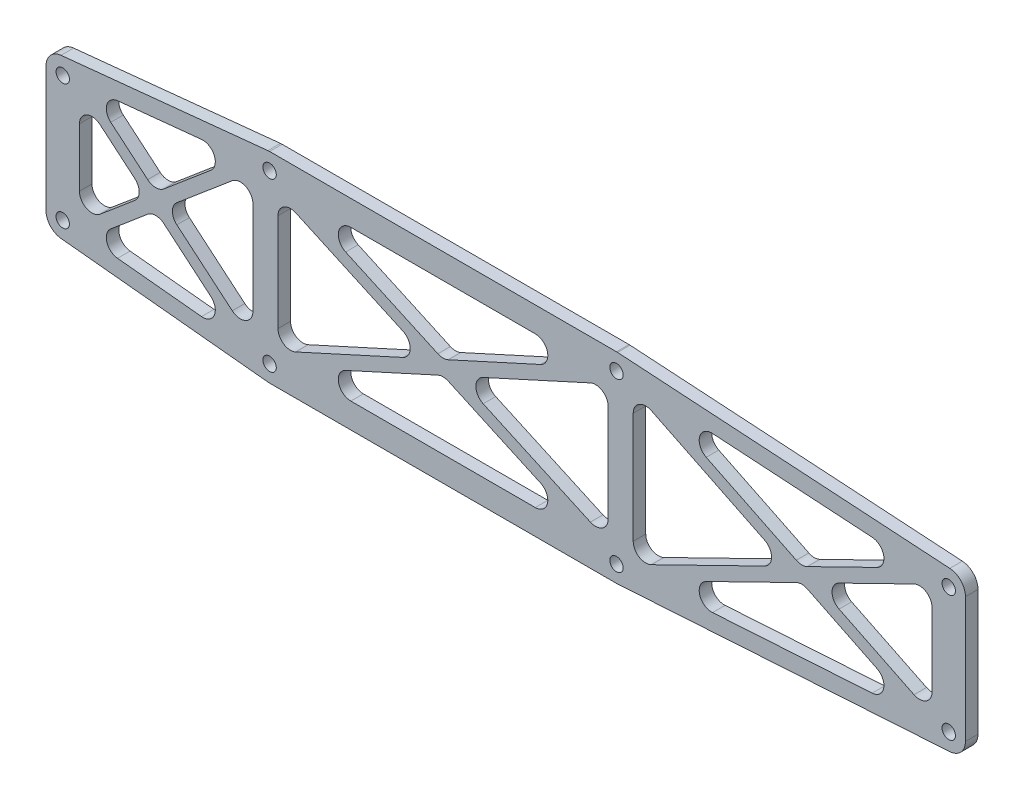
from build123d import *

# Parameters (mm, degrees)
SKETCH_1_W          = 232
SKETCH_1_H          = 56
SKETCH_1_R          = 1.6
EXTRUDE_1_DEPTH     = 3
SKETCH_2_R          = 1.6
CUT_EXTRUDE_1_DEPTH = 10
SKETCH_4_W          = 232
SKETCH_4_H          = 56
CUT_EXTRUDE_2_DEPTH = 5
CUT_EXTRUDE_3_DEPTH = 5
FILLET_1_R          = 3


with BuildPart() as part:
    # 草图1 → 凸台-拉伸1 (new body)
    with BuildSketch(Plane.XY):
        Rectangle(SKETCH_1_W, SKETCH_1_H)
        with Locations((-56.5, 20)):
            Circle(SKETCH_1_R, mode=Mode.SUBTRACT)
        with Locations((-56.5, -20)):
            Circle(SKETCH_1_R, mode=Mode.SUBTRACT)
        with Locations((26.5, -20)):
            Circle(SKETCH_1_R, mode=Mode.SUBTRACT)
        with Locations((26.5, 20)):
            Circle(SKETCH_1_R, mode=Mode.SUBTRACT)
    extrude(amount=EXTRUDE_1_DEPTH)

    # 草图2 → 切除-拉伸1 (cut)
    with BuildSketch(Plane.XY.offset(3)):
        with Locations((-106, 15)):
            Circle(SKETCH_2_R)
        with Locations((-106, -15)):
            Circle(SKETCH_2_R)
        with Locations(Location((106, -15, 0), (0, 0, 180))):
            Circle(SKETCH_2_R)
        with Locations(Location((106, 15, 0), (0, 0, 180))):
            Circle(SKETCH_2_R)
    extrude(amount=-CUT_EXTRUDE_1_DEPTH, mode=Mode.SUBTRACT)

    # 草图4 → 切除-拉伸2 (cut, symmetric)
    with BuildSketch(Plane.XY.offset(3)):
        Rectangle(SKETCH_4_W, SKETCH_4_H)
        with BuildLine():
            ThreePointArc((106.251076246, 18.992112313), (108.915845073, 17.73821977), (110, 15))
            Line((110, 15), (110, -15))
            ThreePointArc((110, -15), (108.915845073, -17.73821977), (106.251076246, -18.992112313))
            Line((106.251076246, -18.992112313), (26.751076246, -23.992112313))
            ThreePointArc((26.751076246, -23.992112313), (26.625600057, -23.998027592), (26.5, -24))
            Line((26.5, -24), (-56.5, -24))
            ThreePointArc((-56.5, -24), (-56.701252299, -23.994933981), (-56.901994824, -23.979748756))
            Line((-56.901994824, -23.979748756), (-106.401994824, -18.979748756))
            ThreePointArc((-106.401994824, -18.979748756), (-108.967151774, -17.682538043), (-110, -15))
            Line((-110, -15), (-110, 15))
            ThreePointArc((-110, 15), (-108.967151774, 17.682538043), (-106.401994824, 18.979748756))
            Line((-106.401994824, 18.979748756), (-56.901994824, 23.979748756))
            ThreePointArc((-56.901994824, 23.979748756), (-56.701252299, 23.994933981), (-56.5, 24))
            Line((-56.5, 24), (26.5, 24))
            ThreePointArc((26.5, 24), (26.625600057, 23.998027592), (26.751076246, 23.992112313))
            Line((26.751076246, 23.992112313), (106.251076246, 18.992112313))
        make_face(mode=Mode.SUBTRACT)
    extrude(amount=CUT_EXTRUDE_2_DEPTH, both=True, mode=Mode.SUBTRACT)

    # 草图6 → 切除-拉伸3 (cut, symmetric)
    with BuildSketch(Plane.XY.offset(3)):
        Polygon((-63.143230899, 19.328966576), (-99.922202515, 15.613918938), (-83.735209235, 1.962237858), align=None)
        Polygon((-60.5, 17.633721737), (-81.408555774, 0), (-60.5, -17.633721737), align=None)
        Polygon((-63.143230899, -19.328966576), (-83.735209235, -1.962237858), (-99.922202515, -15.613918938), align=None)
        Polygon((-86.061862696, 0), (-102, 13.441802546), (-102, -13.441802546), align=None)
        Polygon((-18.617329048, 0), (-54.5, 16.351596889), (-54.5, -16.351596889), align=None)
        Polygon((20.882670952, 18), (-50.882670952, 18), (-15, 1.648403111), align=None)
        Polygon((24.5, 16.351596889), (-11.382670952, 0), (24.5, -16.351596889), align=None)
        Polygon((20.882670952, -18), (-15, -1.648403111), (-50.882670952, -18), align=None)
        Polygon((67.431494542, 0), (30.5, 18.078353971), (30.5, -18.078353971), align=None)
        Polygon((98.97671451, 15.441716069), (34.414687191, 19.502220931), (70.843216532, 1.670073702), align=None)
        Polygon((102, 13.581498626), (74.254938522, 0), (102, -13.581498626), align=None)
        Polygon((98.97671451, -15.441716069), (70.843216532, -1.670073702), (34.414687191, -19.502220931), align=None)
    extrude(amount=CUT_EXTRUDE_3_DEPTH, both=True, mode=Mode.SUBTRACT)

    # 圆角1
    fillet_1_edges = [part.edges().sort_by_distance(p)[0] for p in [
        (-11.382670952, 0, 1.5),
        (24.5, 16.351596889, 1.5),
        (24.5, -16.351596889, 1.5),
        (-15, 1.648403111, 1.5),
        (-50.882670952, 18, 1.5),
        (20.882670952, 18, 1.5),
        (-50.882670952, -18, 1.5),
        (-15, -1.648403111, 1.5),
        (20.882670952, -18, 1.5),
        (30.5, -18.078353971, 1.5),
        (30.5, 18.078353971, 1.5),
        (67.431494542, 0, 1.5),
        (-83.735209235, -1.962237858, 1.5),
        (-63.143230899, -19.328966576, 1.5),
        (-99.922202515, -15.613918938, 1.5),
        (-60.5, 17.633721737, 1.5),
        (-60.5, -17.633721737, 1.5),
        (-81.408555774, 0, 1.5),
        (-86.061862696, 0, 1.5),
        (-102, -13.441802546, 1.5),
        (-102, 13.441802546, 1.5),
        (-54.5, -16.351596889, 1.5),
        (-54.5, 16.351596889, 1.5),
        (-18.617329048, 0, 1.5),
        (34.414687191, -19.502220931, 1.5),
        (70.843216532, -1.670073702, 1.5),
        (98.97671451, -15.441716069, 1.5),
        (70.843216532, 1.670073702, 1.5),
        (34.414687191, 19.502220931, 1.5),
        (98.97671451, 15.441716069, 1.5),
        (74.254938522, 0, 1.5),
        (102, 13.581498626, 1.5),
        (102, -13.581498626, 1.5),
        (-99.922202515, 15.613918938, 1.5),
        (-63.143230899, 19.328966576, 1.5),
        (-83.735209235, 1.962237858, 1.5),
    ]]
    fillet(fillet_1_edges, radius=FILLET_1_R)


solid = part.part
